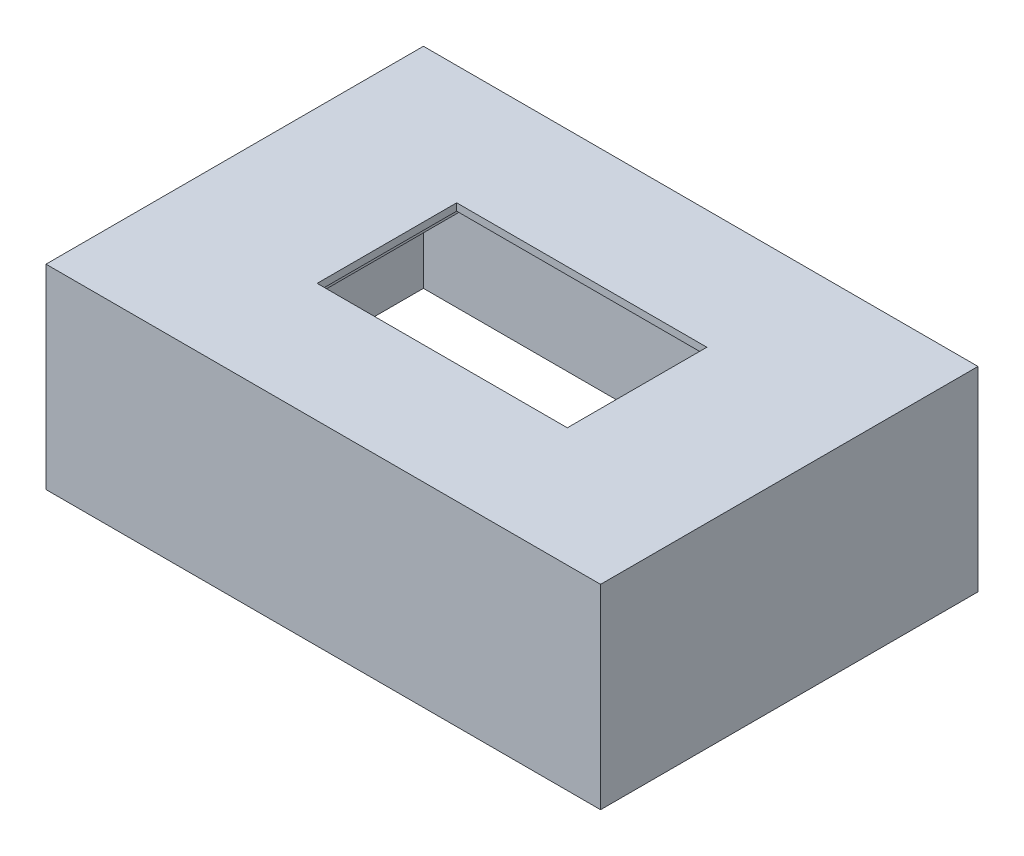
from build123d import *

# Parameters (mm, degrees)
SKETCH_1_W          = 76.7
SKETCH_1_H          = 52.2
SKETCH_1_W_2        = 72.7
SKETCH_1_H_2        = 48.2
EXTRUDE_1_DEPTH     = 25
SKETCH_2_W          = 76.7
SKETCH_2_H          = 52.2
EXTRUDE_2_DEPTH     = 2
SKETCH_3_W          = 34.6
SKETCH_3_H          = 19.3
CUT_EXTRUDE_1_DEPTH = 2
SKETCH_4_W          = 36
SKETCH_4_H          = 34.3
CUT_EXTRUDE_2_DEPTH = 1
CHAMFER_1_SIZE      = 2
CUT_EXTRUDE_3_DEPTH = 2


with BuildPart() as part:
    # Эскиз1 → Бобышка-Вытянуть1 (new body)
    with BuildSketch(Plane(origin=(0, 0, 0), x_dir=(1, 0, 0), z_dir=(0, 1, 0))):
        with Locations((-18.59008079, -31.725044883)):
            Rectangle(SKETCH_1_W, SKETCH_1_H)
        with Locations((-18.59008079, -31.725044883)):
            Rectangle(SKETCH_1_W_2, SKETCH_1_H_2, mode=Mode.SUBTRACT)
    extrude(amount=EXTRUDE_1_DEPTH)

    # Эскиз2 → Бобышка-Вытянуть2 (add)
    with BuildSketch(Plane(origin=(0, 25, 0), x_dir=(1, 0, 0), z_dir=(0, 1, 0))):
        with Locations((-18.59008079, -31.725044883)):
            Rectangle(SKETCH_2_W, SKETCH_2_H)
    extrude(amount=EXTRUDE_2_DEPTH)

    # Эскиз3 → Вырез-Вытянуть1 (cut)
    with BuildSketch(Plane(origin=(0, 27, 0), x_dir=(1, 0, 0), z_dir=(0, 1, 0))):
        with Locations((-18.59008079, -31.725044883)):
            Rectangle(SKETCH_3_W, SKETCH_3_H)
    extrude(amount=-CUT_EXTRUDE_1_DEPTH, mode=Mode.SUBTRACT)

    # Эскиз4 → Вырез-Вытянуть2 (cut)
    with BuildSketch(Plane.XZ.offset(-25)):
        with Locations((-18.59008079, 31.725044883)):
            Rectangle(SKETCH_4_W, SKETCH_4_H)
    extrude(amount=-CUT_EXTRUDE_2_DEPTH, mode=Mode.SUBTRACT)

    # Фаска1
    chamfer_1_edges = [part.edges().sort_by_distance(p)[0] for p in [
        (-54.94008079, 25, 31.725044883),
        (-18.59008079, 25, 55.825044883),
        (17.75991921, 25, 31.725044883),
        (-18.59008079, 25, 7.625044883),
    ]]
    chamfer(chamfer_1_edges, length=CHAMFER_1_SIZE)

    # Эскиз5 → Вырез-Вытянуть3 (cut)
    with BuildSketch(Plane.ZY.offset(56.94008079)):
        with BuildLine():
            Line((35.628323132, 11.545750126), (35.628323132, 0))
            Line((35.628323132, 0), (27.128323132, 0))
            Line((27.128323132, 0), (27.128323132, 11.545750126))
            ThreePointArc((27.128323132, 11.545750126), (31.378323132, 15.795750126), (35.628323132, 11.545750126))
        make_face()
    extrude(amount=-CUT_EXTRUDE_3_DEPTH, mode=Mode.SUBTRACT)


solid = part.part
